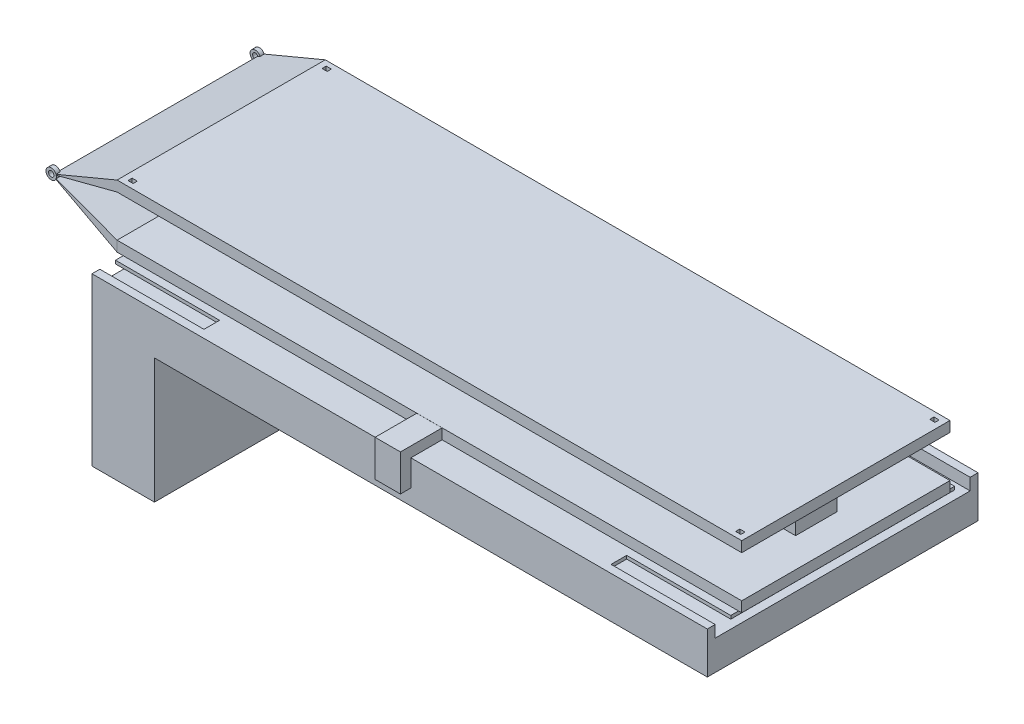
from build123d import *
from build123d.topology import SkipClean

# Parameters (mm, degrees)
SKETCH1_W            = 762
SKETCH1_H            = 254
BOSS_EXTRUDE1_DEPTH  = 12.7
BOSS_EXTRUDE2_DEPTH  = 254
SKETCH9_W            = 6.35
SKETCH9_H            = 5.08
CUT_EXTRUDE1_DEPTH   = 480.700909137
SKETCH5_R            = 6.35
SKETCH5_R_2          = 3.302
BOSS_EXTRUDE8_DEPTH  = 5.08
SKETCH13_W           = 101.6
SKETCH13_H           = 50.8
BOSS_EXTRUDE10_DEPTH = 50.8
SKETCH15_R           = 20.32
CUT_EXTRUDE3_DEPTH   = 90.17
SKETCH16_W           = 50.8
SKETCH16_H           = 50.8
BOSS_EXTRUDE11_DEPTH = 5.08
CUT_EXTRUDE4_REACH   = 826.192
SKETCH17_R           = 5.334
CUT_EXTRUDE6_REACH   = 721.209
SKETCH19_W           = 12.7
SKETCH19_H           = 12.7
SKETCH20_W           = 762
SKETCH20_H           = 254
BOSS_EXTRUDE12_DEPTH = 12.7
BOSS_EXTRUDE15_DEPTH = 254
SKETCH23_R           = 3.302
CUT_EXTRUDE7_DEPTH   = 537.004396119
SKETCH24_W           = 750.592755811
SKETCH24_H           = 330.2
BOSS_EXTRUDE16_DEPTH = 50.8
SKETCH28_W           = 76.2
SKETCH28_H           = 330.2
BOSS_EXTRUDE17_DEPTH = 152.4
BOSS_EXTRUDE9_START  = -5.08
SKETCH12_R           = 6.35
SKETCH12_R_2         = 3.302
BOSS_EXTRUDE9_DEPTH  = 5.08
SKETCH29_W           = 25.4
SKETCH29_H           = 25.4
BOSS_EXTRUDE18_DEPTH = 50.8
SKETCH30_W           = 25.4
SKETCH30_H           = 25.4
BOSS_EXTRUDE19_DEPTH = 50.8
SKETCH31_W           = 30.926953994
SKETCH31_H           = 44.4789806
BOSS_EXTRUDE20_DEPTH = 50.8
SKETCH25_W           = 311.03418717
SKETCH25_H           = 10.464606508
CUT_EXTRUDE8_DEPTH   = 820.751966299
SKETCH32_W           = 19.05
SKETCH32_H           = 14.241541755
CUT_EXTRUDE9_DEPTH   = 127
SKETCH33_W           = 19.05
SKETCH33_H           = 23.618402859
SKETCH33_H_2         = 14.241541755
CUT_EXTRUDE10_DEPTH  = 127


with BuildPart() as part:
    # Sketch1 → Boss-Extrude1 (new body)
    with BuildSketch(Plane(origin=(0, 0, 0), x_dir=(1, 0, 0), z_dir=(0, 1, 0))):
        Rectangle(SKETCH1_W, SKETCH1_H)
    extrude(amount=BOSS_EXTRUDE1_DEPTH)

    # Sketch2 → Boss-Extrude2 (add)
    with BuildSketch(Plane.XY.offset(127)):
        Polygon((-381, 12.7), (-461.359806033, -20.931705337), (-381, 0), align=None)
    extrude(amount=-BOSS_EXTRUDE2_DEPTH)

    # Sketch9 → Cut-Extrude1 (cut, through all)
    with BuildSketch(Plane(origin=(0, 12.7, 0), x_dir=(1, 0, 0), z_dir=(0, 1, 0))):
        with Locations((370.67362949, -118.374235509)):
            Rectangle(SKETCH9_W, SKETCH9_H)
        with Locations((370.67362949, 118.374235509)):
            Rectangle(SKETCH9_W, SKETCH9_H)
        with Locations((-370.67362949, 118.374235509)):
            Rectangle(SKETCH9_W, SKETCH9_H)
        with Locations((-370.67362949, -118.374235509)):
            Rectangle(SKETCH9_W, SKETCH9_H)
    extrude(amount=-CUT_EXTRUDE1_DEPTH, mode=Mode.SUBTRACT)

    # Sketch5 → Boss-Extrude8 (add)
    with BuildSketch(Plane.XY.offset(127)):
        with Locations((-461.359806033, -20.931705337)):
            Circle(SKETCH5_R)
        with Locations((-461.359806033, -20.931705337)):
            Circle(SKETCH5_R_2, mode=Mode.SUBTRACT)
    boss_extrude8 = extrude(amount=-BOSS_EXTRUDE8_DEPTH)

    # Sketch13 → Boss-Extrude10 (add)
    with BuildSketch(Plane.XZ):
        with Locations((289.172611065, 0)):
            Rectangle(SKETCH13_W, SKETCH13_H)
    extrude(amount=BOSS_EXTRUDE10_DEPTH)

    # Sketch15 → Cut-Extrude3 (cut)
    with BuildSketch(Plane(origin=(339.972611065, 0, 0), x_dir=(0, 0, -1), z_dir=(1, 0, 0))):
        with Locations((0, -25.42171176)):
            Circle(SKETCH15_R)
    extrude(amount=-CUT_EXTRUDE3_DEPTH, mode=Mode.SUBTRACT)

    # Sketch16 → Boss-Extrude11 (add)
    with BuildSketch(Plane(origin=(339.972611065, 0, 0), x_dir=(0, 0, -1), z_dir=(1, 0, 0))):
        with Locations((0, -25.4)):
            Rectangle(SKETCH16_W, SKETCH16_H)
    extrude(amount=BOSS_EXTRUDE11_DEPTH)

    # Sketch17 → Cut-Extrude4 (cut, up to next)
    with BuildSketch(Plane(origin=(345.052611065, 0, 0), x_dir=(0, 0, -1), z_dir=(1, 0, 0)), mode=Mode.PRIVATE) as cut_extrude4_sk1:
        with Locations((0, -25.4)):
            Circle(SKETCH17_R)
    cut_extrude4_tool1 = extrude(cut_extrude4_sk1.sketch, amount=-CUT_EXTRUDE4_REACH, mode=Mode.PRIVATE) & part.part
    add(cut_extrude4_tool1.solids().sort_by_distance((345.052611, -25.4, 0))[0], mode=Mode.SUBTRACT)

    # Sketch19 → Cut-Extrude6 (cut, up to next)
    with BuildSketch(Plane.ZY.offset(-238.372611065), mode=Mode.PRIVATE) as cut_extrude6_sk1:
        with Locations((0, -13.066258938)):
            Rectangle(SKETCH19_W, SKETCH19_H)
    cut_extrude6_tool1 = extrude(cut_extrude6_sk1.sketch, amount=-CUT_EXTRUDE6_REACH, mode=Mode.PRIVATE) & part.part
    add(cut_extrude6_tool1.solids().sort_by_distance((238.372611, -13.066259, 0))[0], mode=Mode.SUBTRACT)

    # Sketch20 → Boss-Extrude12 (add)
    with BuildSketch(Plane.XZ.offset(50.8)):
        Rectangle(SKETCH20_W, SKETCH20_H)
    extrude(amount=BOSS_EXTRUDE12_DEPTH)

    # Mirror1: Boss-Extrude8 across plane
    add(boss_extrude8.mirror(Plane.XY))


with BuildPart() as body_2:
    # Sketch22 → Boss-Extrude15 (new body)
    with BuildSketch(Plane.XY.offset(127)):
        Polygon((-381, -50.8), (-461.359806033, -20.931705337), (-381, -63.5), align=None)
    extrude(amount=-BOSS_EXTRUDE15_DEPTH)


with BuildPart() as cut_extrude7_tool:
    # Sketch23 → Cut-Extrude7 (new, through all)
    with SkipClean():  # the faces are left unmerged after this step: merging them gives an invalid solid
        with BuildSketch(Plane.XY.offset(127)):
            with Locations((-461.359806033, -20.931705337)):
                Circle(SKETCH23_R)
        extrude(amount=-CUT_EXTRUDE7_DEPTH)


with BuildPart() as part_1:
    with SkipClean():  # the faces are left unmerged after this step: merging them gives an invalid solid
        add(part.part)

        # Cut-Extrude7: cut by cut_extrude7_tool
        add(cut_extrude7_tool.part, mode=Mode.SUBTRACT)

    # Sketch24 → Boss-Extrude16 (add)
    with SkipClean():  # the faces are left unmerged after this step: merging them gives an invalid solid
        with BuildSketch(Plane.XZ.offset(63.5)):
            with Locations((1.808766177, 0)):
                Rectangle(SKETCH24_W, SKETCH24_H)
        extrude(amount=BOSS_EXTRUDE16_DEPTH)

    # Sketch28 → Boss-Extrude17 (add)
    with SkipClean():  # the faces are left unmerged after this step: merging them gives an invalid solid
        with BuildSketch(Plane.XZ.offset(114.3)):
            with Locations((-335.387611728, 0)):
                Rectangle(SKETCH28_W, SKETCH28_H)
        extrude(amount=BOSS_EXTRUDE17_DEPTH)

    # Sketch12 → Boss-Extrude9 (add)
    with BuildSketch(Plane(origin=(0, 0, -127), x_dir=(-1, 0, 0), z_dir=(0, 0, -1)).offset(BOSS_EXTRUDE9_START)):
        with Locations((461.359806033, -20.931705337)):
            Circle(SKETCH12_R)
        with Locations(Location((461.359806033, -20.931705337, 0), (0, 0, 180))):
            Circle(SKETCH12_R_2, mode=Mode.SUBTRACT)
    extrude(amount=BOSS_EXTRUDE9_DEPTH)

    # Sketch29 → Boss-Extrude18 (add)
    with BuildSketch(Plane.ZY.offset(-238.372611065)):
        with Locations((0, -13.138927811)):
            Rectangle(SKETCH29_W, SKETCH29_H)
    extrude(amount=BOSS_EXTRUDE18_DEPTH)

    # Sketch30 → Boss-Extrude19 (add)
    with BuildSketch(Plane(origin=(0, -50.8, 0), x_dir=(1, 0, 0), z_dir=(0, 1, 0))):
        with Locations((193.255755509, 0)):
            Rectangle(SKETCH30_W, SKETCH30_H)
    extrude(amount=BOSS_EXTRUDE19_DEPTH)

    # Sketch31 → Boss-Extrude20 (add)
    with BuildSketch(Plane.XY.offset(127)):
        with Locations((0, -73.135256809)):
            Rectangle(SKETCH31_W, SKETCH31_H)
    extrude(amount=BOSS_EXTRUDE20_DEPTH)

    # Sketch25 → Cut-Extrude8 (cut, through all)
    with BuildSketch(Plane.ZY.offset(373.487611728)):
        with Locations((0, -72.682025016)):
            Rectangle(SKETCH25_W, SKETCH25_H)
    extrude(amount=-CUT_EXTRUDE8_DEPTH, mode=Mode.SUBTRACT)

    # Sketch32 → Cut-Extrude9 (cut)
    with BuildSketch(Plane.ZY.offset(373.487611728)):
        with Locations((145.992093585, -60.328950885)):
            Rectangle(SKETCH32_W, SKETCH32_H)
        with Locations((-145.992093585, -60.328950885)):
            Rectangle(SKETCH32_W, SKETCH32_H)
    extrude(amount=-CUT_EXTRUDE9_DEPTH, mode=Mode.SUBTRACT)

    # Sketch33 → Cut-Extrude10 (cut)
    with BuildSketch(Plane(origin=(377.105144083, 0, 0), x_dir=(0, 0, -1), z_dir=(1, 0, 0))):
        with Locations((-145.992093585, -55.640520333)):
            Rectangle(SKETCH33_W, SKETCH33_H)
        with Locations((145.992093585, -60.328950885)):
            Rectangle(SKETCH33_W, SKETCH33_H_2)
    extrude(amount=-CUT_EXTRUDE10_DEPTH, mode=Mode.SUBTRACT)


with BuildPart() as body_2_1:
    with SkipClean():  # the faces are left unmerged after this step: merging them gives an invalid solid
        add(body_2.part)

        # Cut-Extrude7: cut by cut_extrude7_tool
        add(cut_extrude7_tool.part, mode=Mode.SUBTRACT)


solid = Compound([part_1.part, body_2_1.part])
